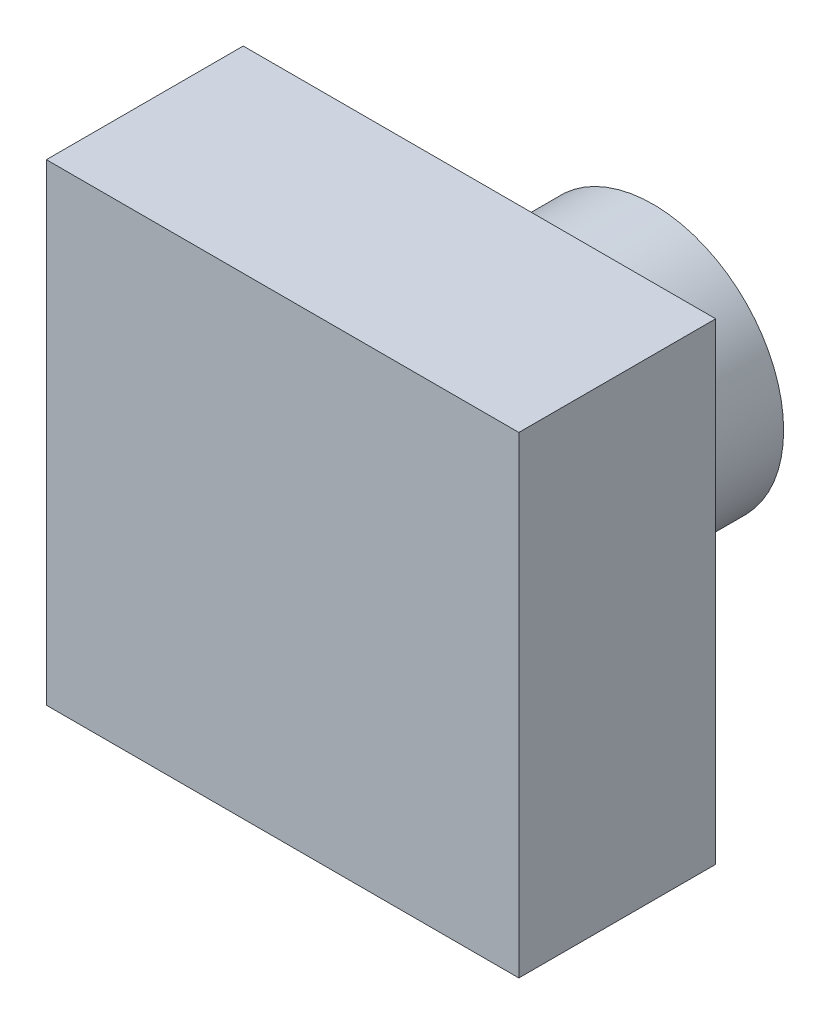
from build123d import *

# Parameters (mm, degrees)
SKETCH_1_R      = 3.315
EXTRUDE_1_DEPTH = 4.41
SKETCH_2_W      = 12
SKETCH_2_H      = 12
EXTRUDE_2_DEPTH = 5


with BuildPart() as part:
    # 草图1 → 凸台-拉伸1 (new body)
    with BuildSketch(Plane.XY):
        Circle(SKETCH_1_R)
    extrude(amount=EXTRUDE_1_DEPTH)

    # 草图2 → 凸台-拉伸2 (add)
    with BuildSketch(Plane.XY.offset(4.41)):
        Rectangle(SKETCH_2_W, SKETCH_2_H)
    extrude(amount=EXTRUDE_2_DEPTH)


solid = part.part
